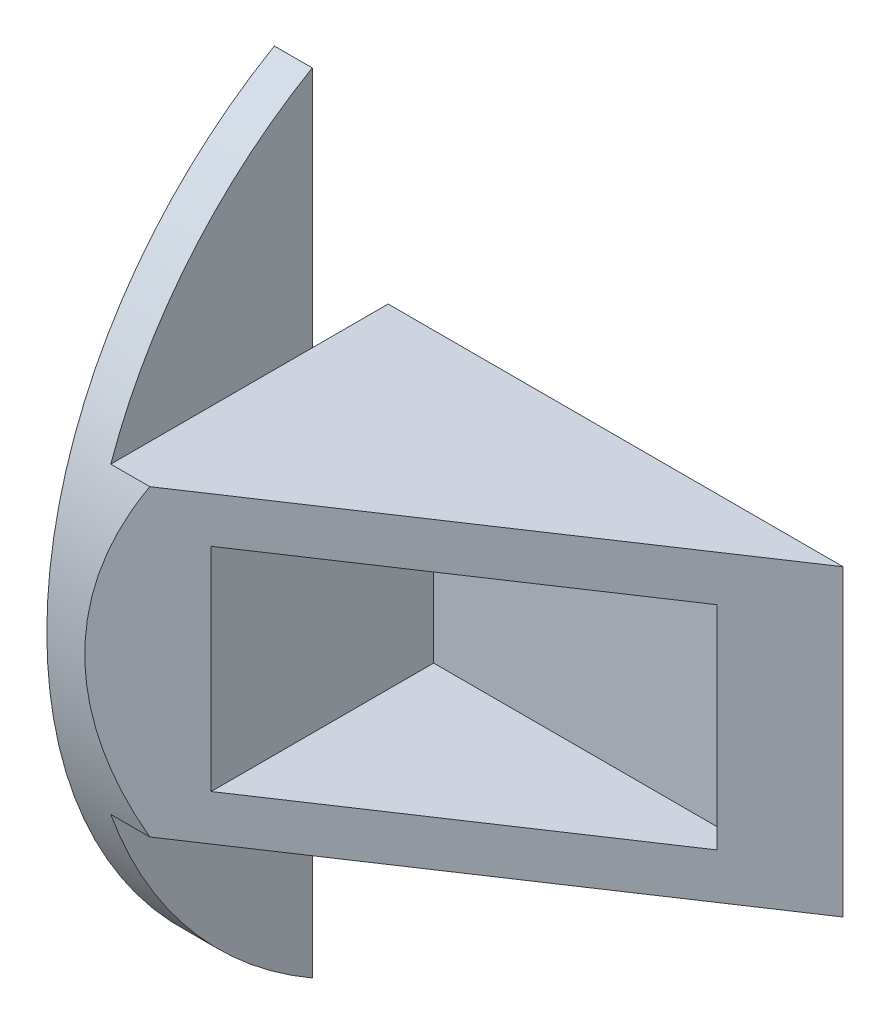
from build123d import *

# Parameters (mm, degrees)
BOSS_EXTRUDE1_DEPTH     = 10
SKETCH2_W               = 16
SKETCH2_H               = 14
CUT_EXTRUDE1_DEPTH      = 10
BOSS_EXTRUDE2_DEPTH     = 2.5
CUT_EXTRUDE_THIN1_START = -32.5
SKETCH3_4_R             = 40
SKETCH3_4_R_2           = 30
CUT_EXTRUDE_THIN1_DEPTH = 32.5


with BuildPart() as part:
    # Sketch1 → Boss-Extrude1 (new, symmetric)
    with BuildSketch(Plane(origin=(0, 0, 0), x_dir=(1, 0, 0), z_dir=(0, 1, 0))):
        Polygon((-15, 10), (-15, -10), (15, 10), align=None)
    extrude(amount=BOSS_EXTRUDE1_DEPTH, both=True)

    # Sketch2 → Cut-Extrude1 (cut, symmetric)
    with BuildSketch(Plane(origin=(0, 0, 0), x_dir=(0, 0, -1), z_dir=(1, 0, 0))):
        Rectangle(SKETCH2_W, SKETCH2_H)
    extrude(amount=CUT_EXTRUDE1_DEPTH, both=True, mode=Mode.SUBTRACT)

    # Sketch3 → Boss-Extrude2 (add)
    with BuildSketch(Plane.ZY.offset(15)):
        with BuildLine():
            Line((-5, 25.980762114), (-5, -25.980762114))
            ThreePointArc((-5, -25.980762114), (10, 0), (-5, 25.980762114))
        make_face()
    extrude(amount=BOSS_EXTRUDE2_DEPTH)

    # Sketch3<4> → Cut-Extrude-Thin1 (cut)
    with BuildSketch(Plane.ZY.offset(15).offset(CUT_EXTRUDE_THIN1_START)):
        with Locations((-20, 0)):
            Circle(SKETCH3_4_R)
        with Locations((-20, 0)):
            Circle(SKETCH3_4_R_2, mode=Mode.SUBTRACT)
    extrude(amount=CUT_EXTRUDE_THIN1_DEPTH, mode=Mode.SUBTRACT)


solid = part.part
